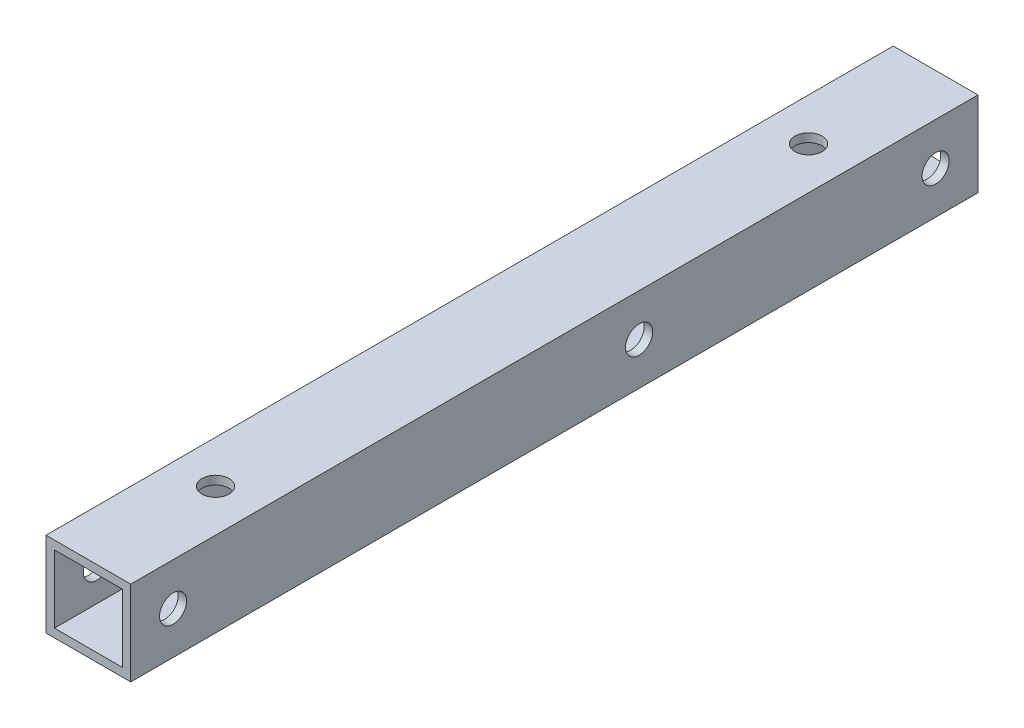
from build123d import *

# Parameters (mm, degrees)
SKETCH_2_W          = 10
SKETCH_2_H          = 10
SKETCH_2_W_2        = 8
SKETCH_2_H_2        = 8
EXTRUDE_1_DEPTH     = 100
SKETCH_3_R          = 1.6
CUT_EXTRUDE_1_DEPTH = 101.623058987
SKETCH_4_R          = 1.6
CUT_EXTRUDE_2_DEPTH = 101.623058987
SKETCH_7_R          = 1.6
CUT_EXTRUDE_4_DEPTH = 101.623058987


with BuildPart() as part:
    # ｽｹｯﾁ2 → 押し出し-薄板1 (new body)
    with BuildSketch(Plane.XY):
        Rectangle(SKETCH_2_W, SKETCH_2_H)
        Rectangle(SKETCH_2_W_2, SKETCH_2_H_2, mode=Mode.SUBTRACT)
    extrude(amount=EXTRUDE_1_DEPTH)

    # ｽｹｯﾁ3 → ｶｯﾄ - 押し出し1 (cut, through all)
    with BuildSketch(Plane(origin=(5, 0, 0), x_dir=(0, 0, -1), z_dir=(1, 0, 0))):
        with Locations(Location((-95, 0, 0), (0, 0, 90))):
            Circle(SKETCH_3_R)
        with Locations(Location((-5, 0, 0), (0, 0, 270))):
            Circle(SKETCH_3_R)
        with Locations(Location((-40, 0, 0), (0, 0, 90))):
            Circle(SKETCH_3_R)
    extrude(amount=-CUT_EXTRUDE_1_DEPTH, mode=Mode.SUBTRACT)

    # ｽｹｯﾁ4 → ｶｯﾄ - 押し出し2 (cut, through all)
    with BuildSketch(Plane(origin=(0, 5, 0), x_dir=(1, 0, 0), z_dir=(0, 1, 0))):
        with Locations(Location((0, -15, 0), (0, 0, 180))):
            Circle(SKETCH_4_R)
    extrude(amount=-CUT_EXTRUDE_2_DEPTH, mode=Mode.SUBTRACT)

    # ｽｹｯﾁ7 → ｶｯﾄ - 押し出し4 (cut, through all)
    with BuildSketch(Plane(origin=(0, 5, 0), x_dir=(1, 0, 0), z_dir=(0, 1, 0))):
        with Locations(Location((0, -85, 0), (0, 0, 180))):
            Circle(SKETCH_7_R)
    extrude(amount=-CUT_EXTRUDE_4_DEPTH, mode=Mode.SUBTRACT)


solid = part.part
